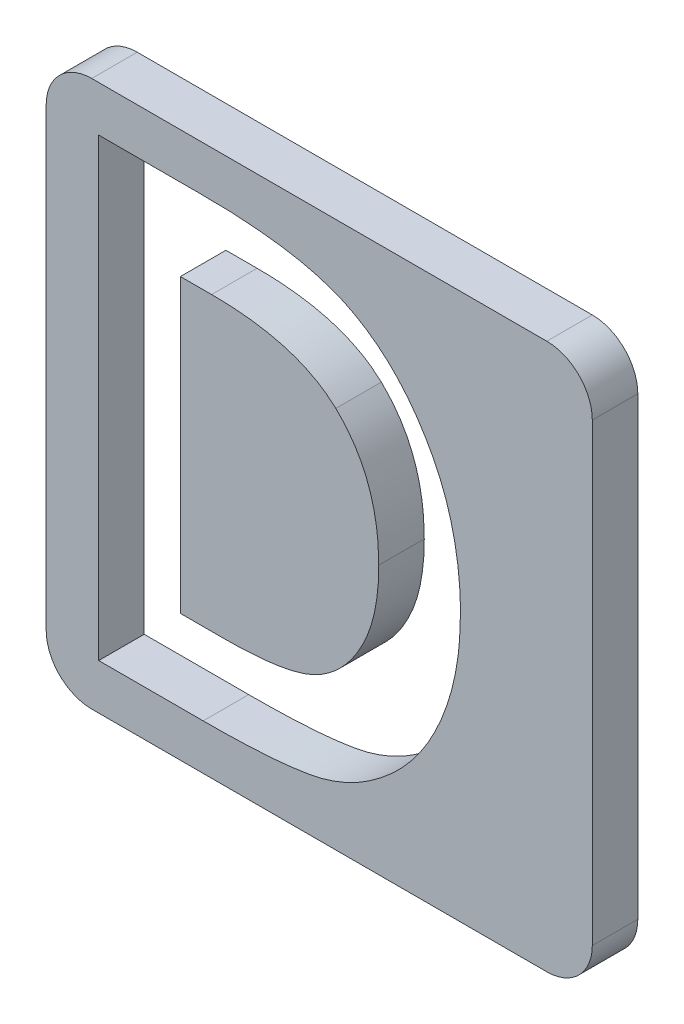
from build123d import *

# Parameters (mm, degrees)
BOSS_EXTRUDE1_DEPTH = 10
CUT_EXTRUDE17_DEPTH = 10


with BuildPart() as part:
    # Sketch1 → Boss-Extrude1 (new body)
    with BuildSketch(Plane.XY):
        with BuildLine():
            Line((-50, 60), (50, 60))
            ThreePointArc((50, 60), (57.071067812, 57.071067812), (60, 50))
            Line((60, 50), (60, -50))
            ThreePointArc((60, -50), (57.071067812, -57.071067812), (50, -60))
            Line((50, -60), (-50, -60))
            ThreePointArc((-50, -60), (-57.071067812, -57.071067812), (-60, -50))
            Line((-60, -50), (-60, 50))
            ThreePointArc((-60, 50), (-57.071067812, 57.071067812), (-50, 60))
        make_face()
    extrude(amount=BOSS_EXTRUDE1_DEPTH)

    # Sketch2 → Cut-Extrude17 (cut)
    with BuildSketch(Plane.XY.offset(10)):
        with BuildLine():
            Line((-48.461538462, 50), (-25.845352564, 50))
            add(Edge.make_bspline(
                [(-25.845352564, 50), (-24.082160742, 49.987674686), (-20.673891012, 49.963849714), (-15.735982447, 49.695399577), (-11.144355841, 49.282542324), (-6.896051342, 48.714582352), (-2.999778658, 47.963015778), (0.539438041, 47.020322812), (3.733477219, 45.932140614), (6.617360853, 44.651673443), (9.250069228, 43.158775888), (11.749909855, 41.495807867), (14.111974354, 39.601850002), (16.369410563, 37.513440515), (18.49308579, 35.192372596), (20.518366839, 32.677091539), (22.395665633, 29.931122295), (24.181728861, 27.020304552), (25.796985387, 23.932302541), (27.205872485, 20.693400689), (28.386105749, 17.324442539), (29.345106395, 13.821837658), (30.109540588, 10.197213625), (30.644399787, 6.443256293), (30.975055072, 2.563441196), (31.008597286, -0.066099994), (31.025641026, -1.40224359)],
                knots=[0, 0, 0, 0, 1.44355588, 2.790409838, 4.047694926, 5.217575253, 6.298404546, 7.294384826, 8.214239204, 9.058592145, 9.873746385, 10.689560431, 11.514393297, 12.350027578, 13.205127629, 14.088021785, 14.991911688, 15.926770944, 16.882954281, 17.842803888, 18.816321264, 19.80318086, 20.814351908, 21.847355356, 22.906180909, 24, 24, 24, 24], degree=3))
            add(Edge.make_bspline(
                [(31.025641026, -1.40224359), (30.981011315, -3.287629175), (30.893155118, -6.999121063), (30.153103587, -12.445692648), (28.956189681, -17.666774746), (27.273220019, -22.621526024), (25.186788159, -27.265823698), (22.694311666, -31.51776752), (19.832336049, -35.354535213), (16.634203493, -38.757022818), (13.17140484, -41.681507029), (9.572858759, -44.18611374), (5.803508857, -46.161205126), (2.482184812, -47.413708419), (-0.397817491, -48.192657106), (-2.926428357, -48.653023281), (-5.7986723, -49.075206827), (-9.041330495, -49.401461191), (-12.640178109, -49.692399907), (-16.60956019, -49.850484682), (-20.936625018, -49.981829664), (-23.942180668, -49.993784518), (-25.504807692, -50)],
                knots=[0, 0, 0, 0, 1.315458931, 2.589557908, 3.828601765, 5.048913369, 6.235739168, 7.376350998, 8.481830359, 9.569842114, 10.627874879, 11.640079404, 12.624025415, 13.590060155, 14.111227486, 14.704434459, 15.382649715, 16.137166398, 16.978595427, 17.902333227, 18.909396075, 20, 20, 20, 20], degree=3))
            Line((-25.504807692, -50), (-48.461538462, -50))
            Line((-48.461538462, -50), (-48.461538462, 50))
        make_face()
        with BuildLine():
            Line((-30.512820513, 32.051282051), (-30.512820513, -32.051282051))
            Line((-30.512820513, -32.051282051), (-21.137820513, -32.051282051))
            add(Edge.make_bspline(
                [(-21.137820513, -32.051282051), (-20.022339491, -32.049238028), (-17.876898139, -32.045306691), (-14.779366471, -31.858053727), (-11.914935082, -31.670103388), (-9.291489078, -31.313367358), (-6.889935839, -30.915988524), (-4.743266416, -30.362981465), (-2.807228622, -29.782094397), (-1.10547079, -29.042553162), (0.453200729, -28.210150282), (1.896352519, -27.234893807), (3.289398046, -26.151908272), (4.606293203, -24.929341533), (5.852022118, -23.583382669), (7.019214274, -22.107096551), (8.123448597, -20.504987375), (9.136381479, -18.768584388), (10.062004971, -16.9162244), (10.883136731, -14.965850217), (11.563976126, -12.901219421), (12.129848148, -10.741659445), (12.534227872, -8.468368865), (12.868774965, -6.098185629), (13.04124374, -3.621719269), (13.064914004, -1.936648792), (13.076923077, -1.081730769)],
                knots=[0, 0, 0, 0, 1.50275155, 2.890291501, 4.180787663, 5.369391935, 6.45668281, 7.458360028, 8.354766181, 9.177074746, 9.954075863, 10.732690366, 11.5210699, 12.329727389, 13.151100085, 13.990027547, 14.863562427, 15.770965086, 16.696477834, 17.652329173, 18.619756807, 19.62365428, 20.657822005, 21.729286259, 22.847956731, 24, 24, 24, 24], degree=3))
            add(Edge.make_bspline(
                [(13.076923077, -1.081730769), (13.053005079, 0.228350281), (13.006366837, 2.78290682), (12.556597719, 6.503674179), (11.824459395, 10.007334043), (10.779768546, 13.280883392), (9.462903354, 16.333522618), (7.814539595, 19.139389398), (5.905616497, 21.745618433), (4.396092194, 23.274516009), (3.641826923, 24.038461538)],
                knots=[0, 0, 0, 0, 1.13821349, 2.219428113, 3.251817212, 4.244760574, 5.201143372, 6.134805572, 7.068016741, 8, 8, 8, 8], degree=3))
            add(Edge.make_bspline(
                [(3.641826923, 24.038461538), (2.898049947, 24.689446406), (1.378969693, 26.019009285), (-1.288036039, 27.612165629), (-4.226938227, 29.011909632), (-7.504970144, 30.121750526), (-11.090451066, 30.999460017), (-15.00473619, 31.604794791), (-19.226863674, 31.9937765), (-22.151855217, 32.031702865), (-23.661858974, 32.051282051)],
                knots=[0, 0, 0, 0, 0.813307809, 1.661089106, 2.549956539, 3.493439533, 4.508053171, 5.589449661, 6.755572447, 8, 8, 8, 8], degree=3))
            Line((-23.661858974, 32.051282051), (-30.512820513, 32.051282051))
        make_face(mode=Mode.SUBTRACT)
    extrude(amount=-CUT_EXTRUDE17_DEPTH, mode=Mode.SUBTRACT)


with BuildPart() as cut_extrude17_piece_1:
    # of the separate pieces the step leaves, piece 1, a body of its own (cut_extrude17_pieces)
    add(part.part.solids().sort_by_distance((-50, 60, 0))[0])


with BuildPart() as cut_extrude17_piece_2:
    # of the separate pieces the step leaves, piece 2, a body of its own (cut_extrude17_pieces)
    add(part.part.solids().sort_by_distance((-30.512820513, 32.051282051, 0))[0])


solid = Compound([cut_extrude17_piece_1.part, cut_extrude17_piece_2.part])
